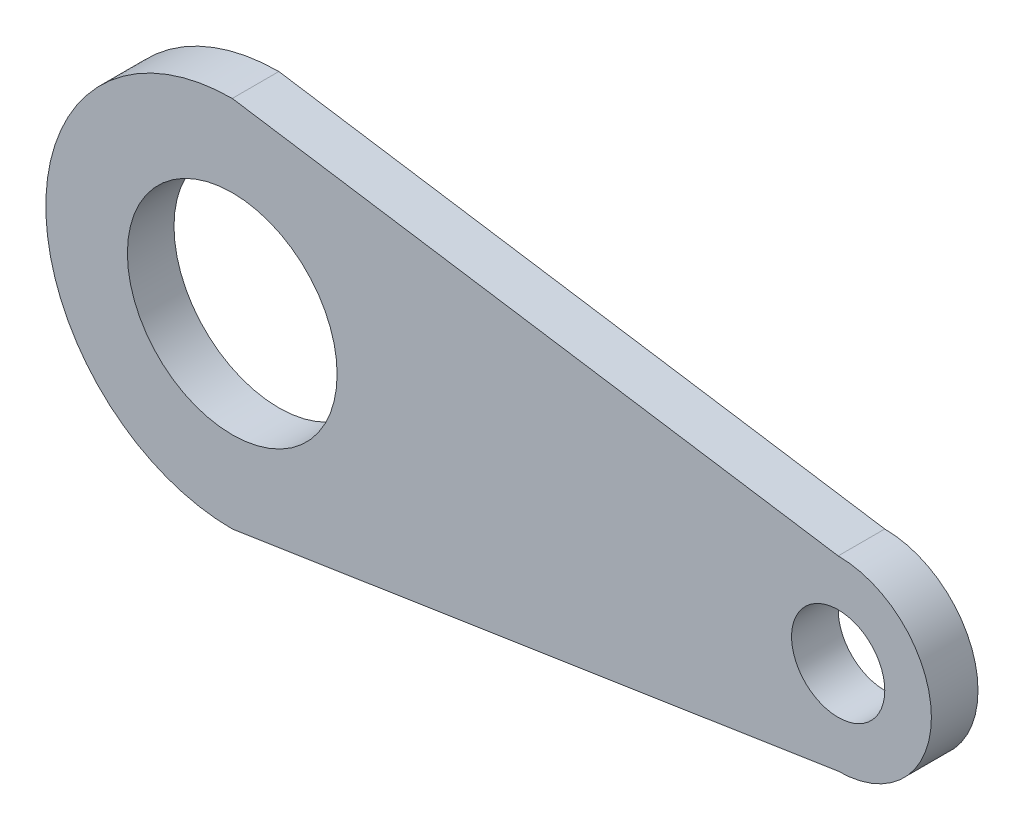
from build123d import *

# Parameters (mm, degrees)
SKETCH1_R           = 10
SKETCH1_R_2         = 22.5
BOSS_EXTRUDE1_DEPTH = 10


with BuildPart() as part:
    # Sketch1 → Boss-Extrude1 (new body)
    with BuildSketch(Plane.XY):
        with BuildLine():
            Line((-57.043314501, 40), (72.956685499, 20))
            ThreePointArc((72.956685499, 20), (92.956685499, 0), (72.956685499, -20))
            Line((72.956685499, -20), (-57.043314501, -40))
            ThreePointArc((-57.043314501, -40), (-97.043314501, 0), (-57.043314501, 40))
        make_face()
        with Locations((72.956685499, 0)):
            Circle(SKETCH1_R, mode=Mode.SUBTRACT)
        with Locations((-57.043314501, 0)):
            Circle(SKETCH1_R_2, mode=Mode.SUBTRACT)
    extrude(amount=BOSS_EXTRUDE1_DEPTH)


solid = part.part
